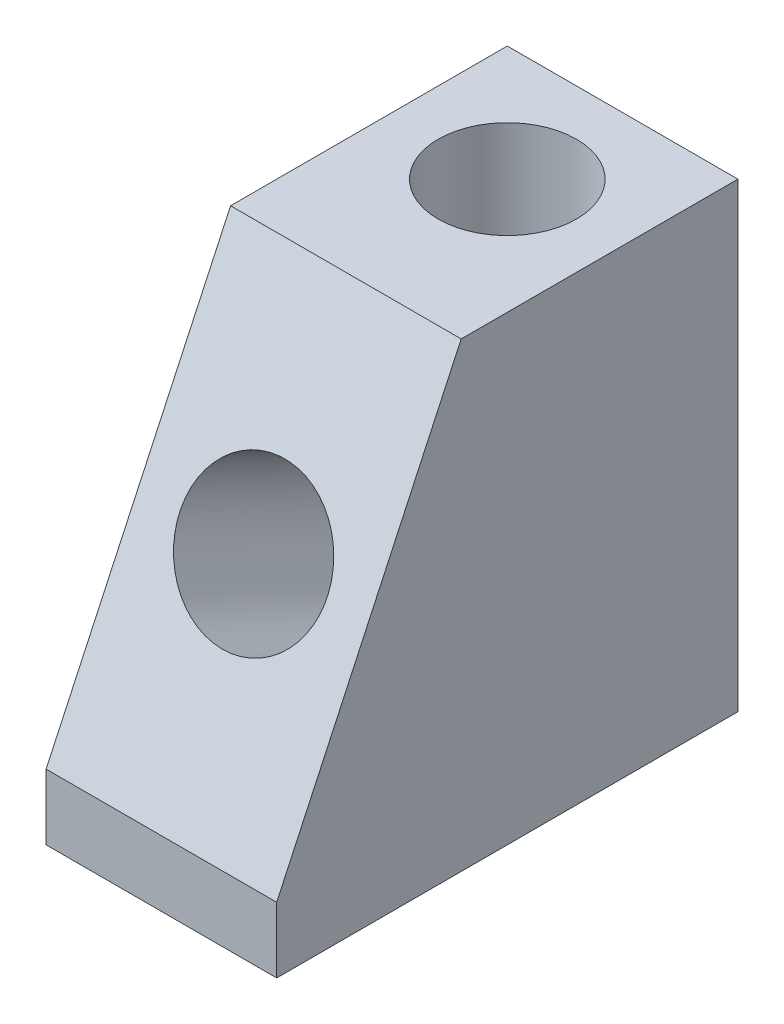
from build123d import *

# Parameters (mm, degrees)
SKETCH_1_W          = 5
SKETCH_1_H          = 10
SKETCH_1_R          = 1.5
EXTRUDE_1_DEPTH     = 10
CUT_EXTRUDE_1_DEPTH = 5
SKETCH_3_R          = 1.6
CUT_EXTRUDE_2_DEPTH = 16.204427687


with BuildPart() as part:
    # 草图1 → 凸台-拉伸1 (new body)
    with BuildSketch(Plane(origin=(0, 0, 0), x_dir=(1, 0, 0), z_dir=(0, 1, 0))):
        with Locations((2.5, 5)):
            Rectangle(SKETCH_1_W, SKETCH_1_H)
        with Locations(Location((2.5, 7.5, 0), (0, 0, 270))):
            Circle(SKETCH_1_R, mode=Mode.SUBTRACT)
    extrude(amount=EXTRUDE_1_DEPTH)

    # 草图2 → 切除-拉伸1 (cut)
    with BuildSketch(Plane(origin=(5, 0, 0), x_dir=(0, 0, -1), z_dir=(1, 0, 0))):
        Polygon((0, 1.421972318), (4, 10), (0, 10), align=None)
    extrude(amount=-CUT_EXTRUDE_1_DEPTH, mode=Mode.SUBTRACT)

    # 草图3 → 切除-拉伸2 (cut, through all)
    with BuildSketch(Plane(origin=(0, 0.253973065, 0.544646996), x_dir=(1, 0, 0), z_dir=(0, 0.4226182617406973, 0.906307787036651))):
        with Locations(Location((2.5, 6.021147751, 0), (0, 0, 270))):
            Circle(SKETCH_3_R)
    extrude(amount=-CUT_EXTRUDE_2_DEPTH, mode=Mode.SUBTRACT)


solid = part.part
